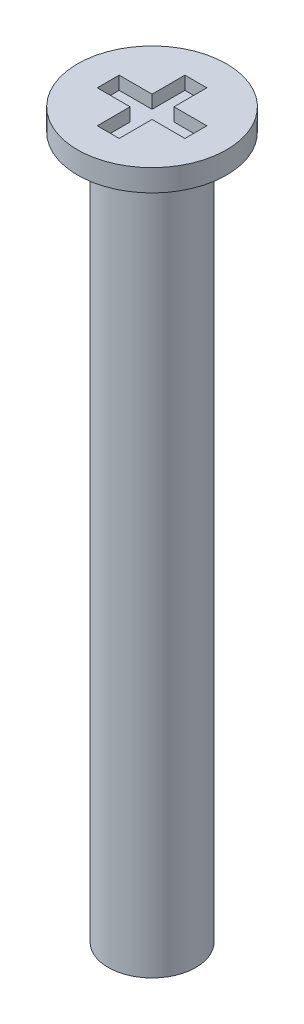
from build123d import *

# Parameters (mm, degrees)
SKETCH_2_W               = 0.5
SKETCH_2_H               = 1
CUT_EXTRUDE_1_DEPTH      = 0.3
PATTERN_CIRCULAR_1_COUNT = 4


with BuildPart() as part:
    # ｽｹｯﾁ1 → 回転1 (revolve)
    with BuildSketch(Plane.XY, mode=Mode.PRIVATE) as revolve_1_sk:
        Polygon((0, 0), (1.7, 0), (1.7, -0.5), (1, -0.5), (1, -16.5), (0, -16.5), align=None)
    revolve(revolve_1_sk.sketch.rotate(Axis((0, -16.5, 0), (0, 1, 0)), 90), axis=Axis((0, -16.5, 0), (0, 1, 0)))

    # ｽｹｯﾁ2 → ｶｯﾄ - 押し出し1 (cut)
    with BuildSketch(Plane(origin=(0, 0, 0), x_dir=(1, 0, 0), z_dir=(0, 1, 0))):
        with Locations((0, 0.5)):
            Rectangle(SKETCH_2_W, SKETCH_2_H)
    cut_extrude_1 = extrude(amount=-CUT_EXTRUDE_1_DEPTH, mode=Mode.SUBTRACT)

    # 円形ﾊﾟﾀｰﾝ1: ｶｯﾄ - 押し出し1 ×4 about axis
    pattern_circular_1_axis = Axis((0, 0, 0), (0, 1, 0))
    for i in range(1, PATTERN_CIRCULAR_1_COUNT):
        add(cut_extrude_1.rotate(pattern_circular_1_axis, i * 360 / PATTERN_CIRCULAR_1_COUNT), mode=Mode.SUBTRACT)


solid = part.part
